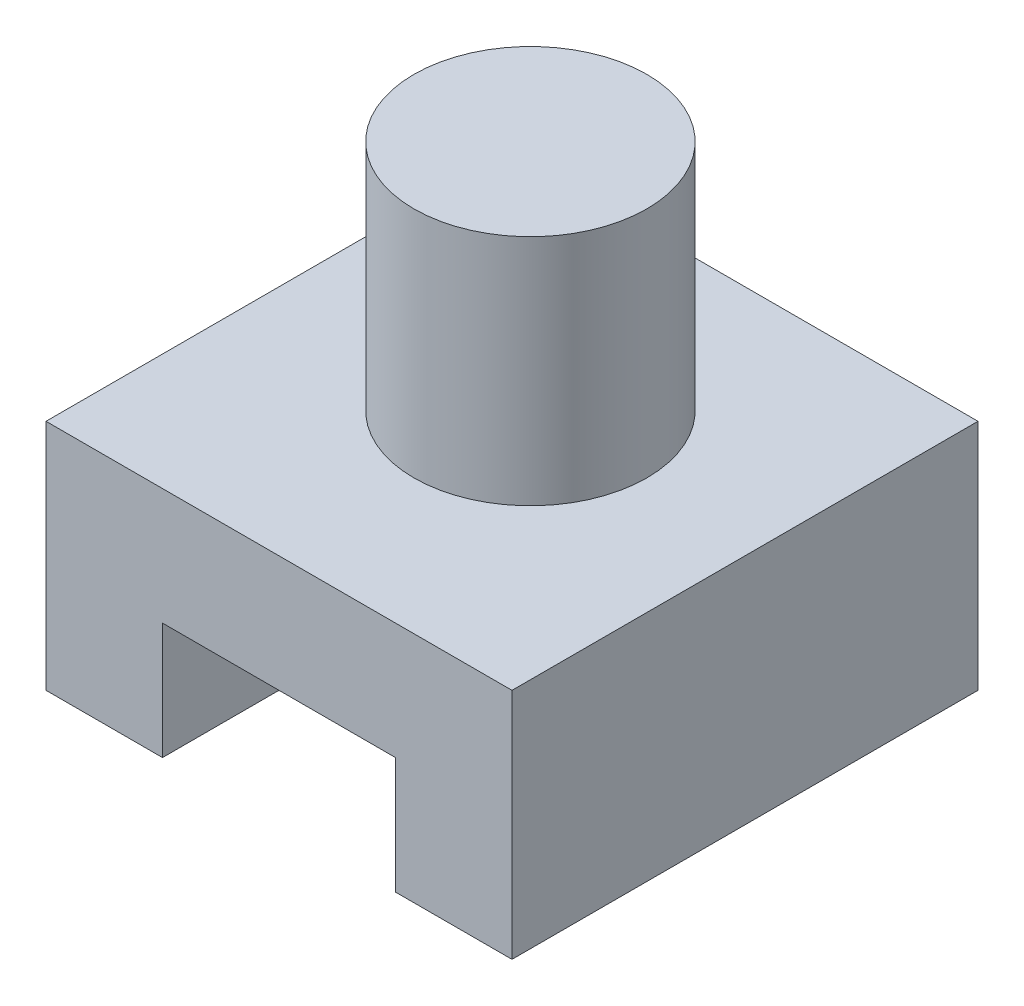
from build123d import *

# Parameters (mm, degrees)
SKETCH2_W           = 40
SKETCH2_H           = 40
BOSS_EXTRUDE1_DEPTH = 20
SKETCH3_W           = 20
SKETCH3_H           = 10
CUT_EXTRUDE1_DEPTH  = 20
SKETCH6_R           = 10
BOSS_EXTRUDE2_DEPTH = 20


with BuildPart() as part:
    # Sketch2 → Boss-Extrude1 (new body)
    with BuildSketch(Plane(origin=(0, 0, 0), x_dir=(1, 0, 0), z_dir=(0, 1, 0))):
        with Locations((20, 20)):
            Rectangle(SKETCH2_W, SKETCH2_H)
    extrude(amount=BOSS_EXTRUDE1_DEPTH)

    # Sketch3 → Cut-Extrude1 (cut)
    with BuildSketch(Plane.XY):
        with Locations((20, 5)):
            Rectangle(SKETCH3_W, SKETCH3_H)
    extrude(amount=-CUT_EXTRUDE1_DEPTH, mode=Mode.SUBTRACT)

    # Sketch6 → Boss-Extrude2 (add)
    with BuildSketch(Plane(origin=(0, 20, 0), x_dir=(1, 0, 0), z_dir=(0, 1, 0))):
        with Locations(Location((20, 21.579352737, 0), (0, 0, 270))):
            Circle(SKETCH6_R)
    extrude(amount=BOSS_EXTRUDE2_DEPTH)


solid = part.part
